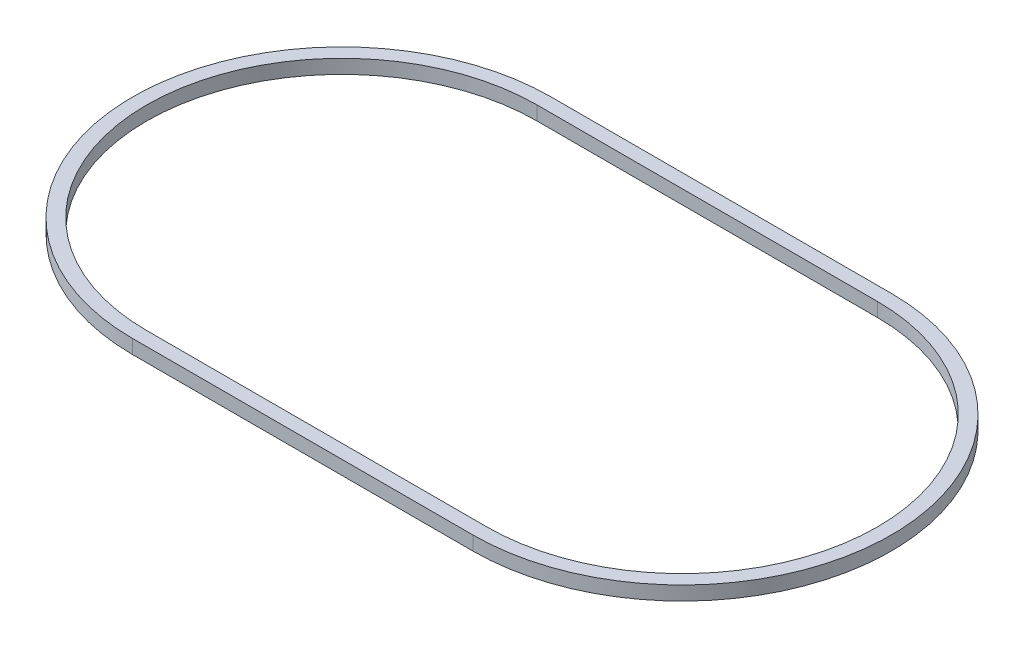
from build123d import *

# Parameters (mm, degrees)
BOSS_EXTRUDE1_DEPTH = 2.5


with BuildPart() as part:
    # Sketch1 → Boss-Extrude1 (new body)
    with BuildSketch(Plane(origin=(0, 0, 0), x_dir=(1, 0, 0), z_dir=(0, 1, 0))):
        with BuildLine():
            Line((0, 37.5), (61, 37.5))
            ThreePointArc((61, 37.5), (98.5, 0), (61, -37.5))
            Line((61, -37.5), (0, -37.5))
            ThreePointArc((0, -37.5), (-37.5, 0), (0, 37.5))
        make_face()
        with BuildLine():
            Line((0, 35), (61, 35))
            ThreePointArc((61, 35), (96, 0), (61, -35))
            Line((61, -35), (0, -35))
            ThreePointArc((0, -35), (-35, 0), (0, 35))
        make_face(mode=Mode.SUBTRACT)
    extrude(amount=BOSS_EXTRUDE1_DEPTH)


solid = part.part
